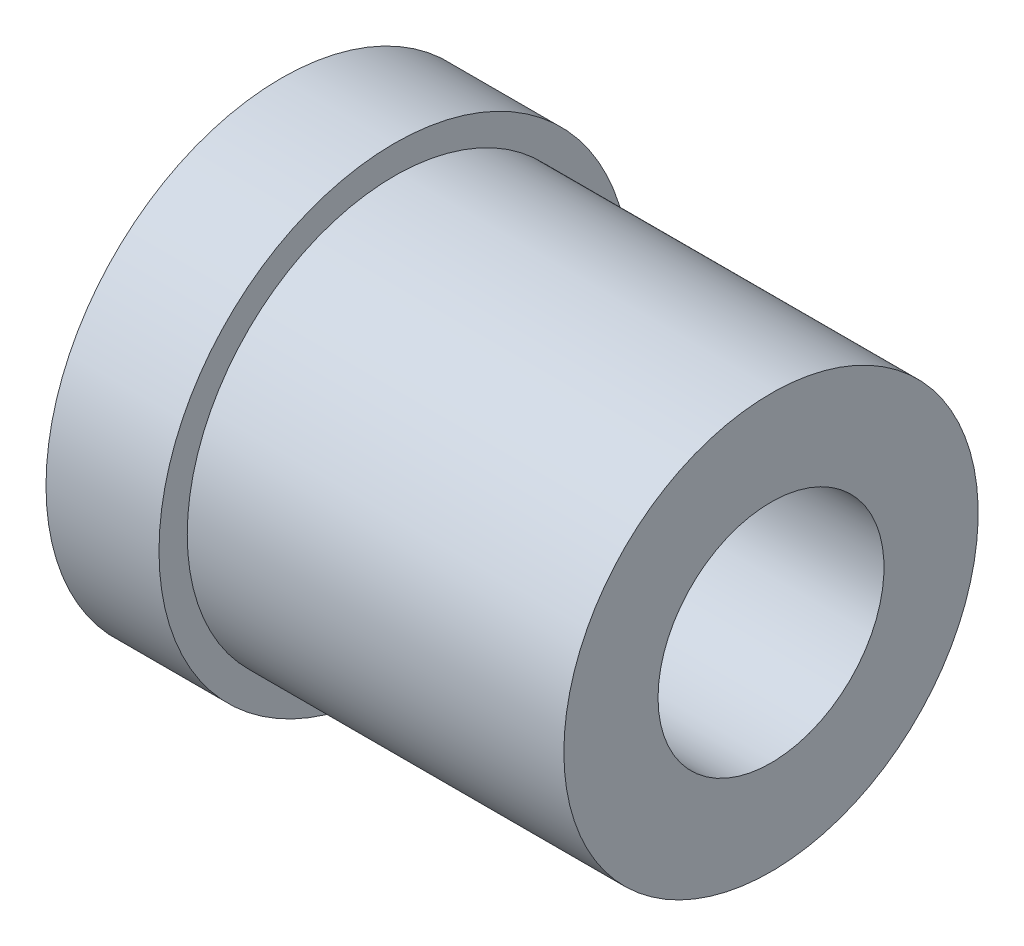
from build123d import *


with BuildPart() as part:
    # Эскиз1 → Повернуть1 (revolve)
    with BuildSketch(Plane.XY, mode=Mode.PRIVATE) as revolve_1_sk:
        Polygon((0, 12.5), (0, 6), (26, 6), (26, 11), (6, 11), (6, 12.5), align=None)
    revolve(revolve_1_sk.sketch.rotate(Axis((0, 0, 0), (1, 0, 0)), 90), axis=Axis((0, 0, 0), (1, 0, 0)))


solid = part.part
